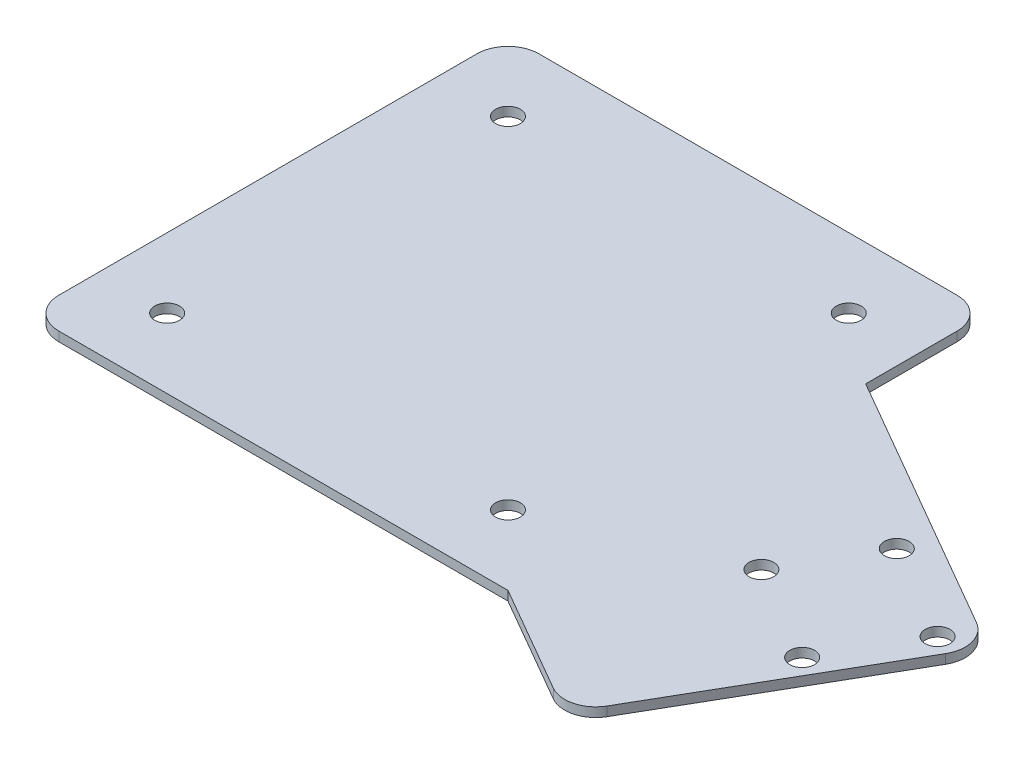
from build123d import *

# Parameters (mm, degrees)
SZKIC1_R                    = 4
DODANIE_WYCI_GNI_CIE1_DEPTH = 3
ZAOKR_GLENIE1_R             = 10


with BuildPart() as part:
    # Szkic1 → Dodanie-wyciągnięcie1 (new body)
    with BuildSketch(Plane(origin=(0, 0, 0), x_dir=(1, 0, 0), z_dir=(0, 1, 0))):
        Polygon((77.5, -77.5), (120.801270189, -102.5), (170.801270189, -15.897459622), (77.5, 37.970053838), (77.5, 77.5), (-77.5, 77.5), (-77.5, -77.5), align=None)
        with Locations(Location((-55, 55, 0), (0, 0, 270))):
            Circle(SZKIC1_R, mode=Mode.SUBTRACT)
        with Locations(Location((55, 55, 0), (0, 0, 270))):
            Circle(SZKIC1_R, mode=Mode.SUBTRACT)
        with Locations(Location((55, -55, 0), (0, 0, 270))):
            Circle(SZKIC1_R, mode=Mode.SUBTRACT)
        with Locations(Location((-55, -55, 0), (0, 0, 270))):
            Circle(SZKIC1_R, mode=Mode.SUBTRACT)
        with Locations(Location((159.739092363, -21.057713659, 0), (0, 0, 270))):
            Circle(SZKIC1_R, mode=Mode.SUBTRACT)
        with Locations(Location((143.739092363, -48.770526581, 0), (0, 0, 270))):
            Circle(SZKIC1_R, mode=Mode.SUBTRACT)
        with Locations(Location((128.562177826, -3.057713659, 0), (0, 0, 90))):
            Circle(SZKIC1_R, mode=Mode.SUBTRACT)
        with Locations(Location((112.562177826, -30.770526581, 0), (0, 0, 90))):
            Circle(SZKIC1_R, mode=Mode.SUBTRACT)
    extrude(amount=DODANIE_WYCI_GNI_CIE1_DEPTH)

    # Zaokrąglenie1
    zaokr_glenie1_edges = [part.edges().sort_by_distance(p)[0] for p in [
        (-77.5, 1.5, -77.5),
        (77.5, 1.5, -77.5),
        (170.801270189, 1.5, 15.897459622),
        (120.801270189, 1.5, 102.5),
        (-77.5, 1.5, 77.5),
    ]]
    fillet(zaokr_glenie1_edges, radius=ZAOKR_GLENIE1_R)


solid = part.part
